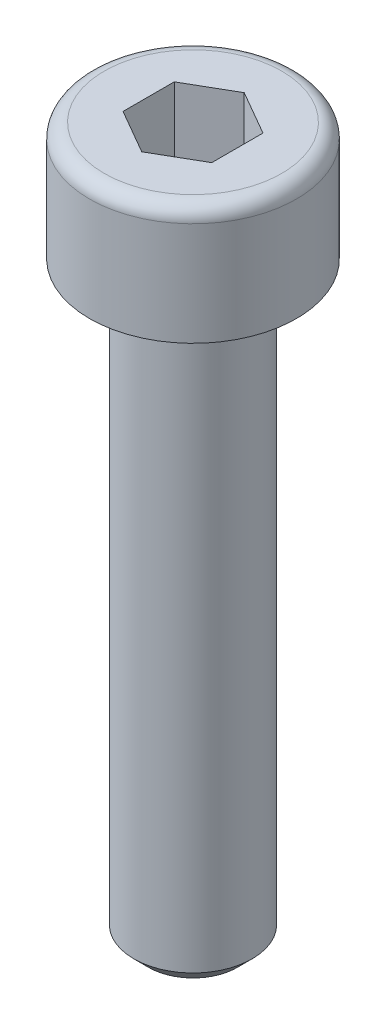
from build123d import *

# Parameters (mm, degrees)
CORTAR_EXTRUIR1_DEPTH = 3
CHAFL_N1_SIZE         = 0.5
REDONDEO1_R           = 0.5


with BuildPart() as part:
    # Croquis1 → Revolución1 (revolve)
    with BuildSketch(Plane.XY, mode=Mode.PRIVATE) as revoluci_n1_sk:
        Polygon((0, 0), (3.5, 0), (3.5, -4), (2, -4), (2, -24), (0, -24), align=None)
    revolve(revoluci_n1_sk.sketch.rotate(Axis((0, 0, 0), (0, -1, 0)), 90), axis=Axis((0, 0, 0), (0, -1, 0)))

    # Croquis2 → Cortar-Extruir1 (cut)
    with BuildSketch(Plane(origin=(0, 0, 0), x_dir=(1, 0, 0), z_dir=(0, 1, 0))):
        Polygon((1.5, 0.866025404), (0, 1.732050808), (-1.5, 0.866025404), (-1.5, -0.866025404), (0, -1.732050808), (1.5, -0.866025404), align=None)
    extrude(amount=-CORTAR_EXTRUIR1_DEPTH, mode=Mode.SUBTRACT)

    # Chaflán1
    chafl_n1_edges = [part.edges().sort_by_distance(p)[0] for p in [
        (0, -24, -2),
    ]]
    chamfer(chafl_n1_edges, length=CHAFL_N1_SIZE)

    # Redondeo1
    redondeo1_edges = [part.edges().sort_by_distance(p)[0] for p in [
        (0, 0, -3.5),
    ]]
    fillet(redondeo1_edges, radius=REDONDEO1_R)


solid = part.part
